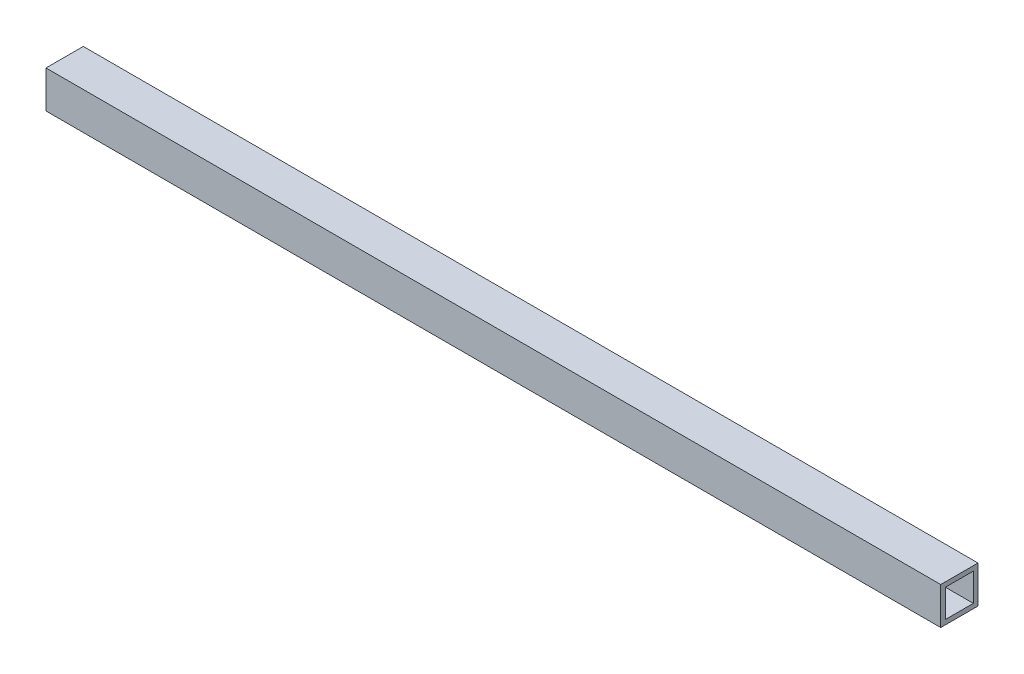
from build123d import *

# Parameters (mm, degrees)
SKETCH2_W           = 25.4
SKETCH2_H           = 25.4
SKETCH2_W_2         = 19.05
SKETCH2_H_2         = 19.05
BOSS_EXTRUDE1_DEPTH = 609.6


with BuildPart() as part:
    # Sketch2 → Boss-Extrude1 (new body)
    with BuildSketch(Plane(origin=(0, 0, 0), x_dir=(0, 0, -1), z_dir=(1, 0, 0))):
        Rectangle(SKETCH2_W, SKETCH2_H)
        Rectangle(SKETCH2_W_2, SKETCH2_H_2, mode=Mode.SUBTRACT)
    extrude(amount=BOSS_EXTRUDE1_DEPTH)


solid = part.part
